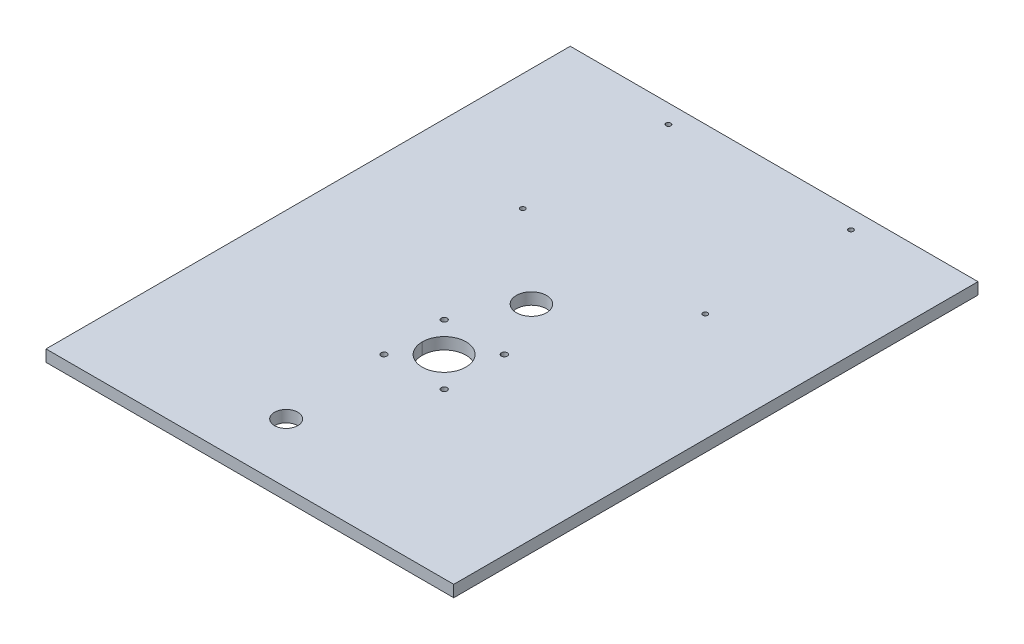
from build123d import *

# Parameters (mm, degrees)
SKETCH1_W           = 210
SKETCH1_H           = 270
SKETCH1_R           = 7.75
BOSS_EXTRUDE2_DEPTH = 6
CUT_EXTRUDE1_DEPTH  = 10
SKETCH4_R           = 1.25
CUT_EXTRUDE2_DEPTH  = 10
SKETCH5_R           = 6
CUT_EXTRUDE3_DEPTH  = 10


with BuildPart() as part:
    # Sketch1 → Boss-Extrude2 (new body)
    with BuildSketch(Plane(origin=(0, 0, 0), x_dir=(1, 0, 0), z_dir=(0, 1, 0))):
        with Locations((0, -10)):
            Rectangle(SKETCH1_W, SKETCH1_H)
        with Locations(Location((0, 0, 0), (0, 0, 270))):
            Circle(SKETCH1_R, mode=Mode.SUBTRACT)
    extrude(amount=BOSS_EXTRUDE2_DEPTH)

    # Sketch3 → Cut-Extrude1 (cut)
    with BuildSketch(Plane.XZ):
        with BuildLine():
            Line((17.000022153, 29.5), (17.000022153, 29.4))
            ThreePointArc((17.000022153, 29.4), (15.500022153, 27.9), (14.000022153, 29.4))
            Line((14.000022153, 29.4), (14.000022153, 29.5))
            ThreePointArc((14.000022153, 29.5), (15.500022153, 31), (17.000022153, 29.5))
        make_face()
        with BuildLine():
            Line((17.000022153, 60.5), (17.000022153, 60.4))
            ThreePointArc((17.000022153, 60.4), (15.500022153, 58.9), (14.000022153, 60.4))
            Line((14.000022153, 60.4), (14.000022153, 60.5))
            ThreePointArc((14.000022153, 60.5), (15.500022153, 62), (17.000022153, 60.5))
        make_face()
        with BuildLine():
            Line((-16.999993108, 29.500016738), (-16.999993206, 29.400016738))
            ThreePointArc((-16.999993206, 29.400016738), (-15.499994683, 27.900015261), (-13.999993206, 29.400013784))
            Line((-13.999993206, 29.400013784), (-13.999993108, 29.500013784))
            ThreePointArc((-13.999993108, 29.500013784), (-15.499991631, 31.000015261), (-16.999993108, 29.500016738))
        make_face()
        with BuildLine():
            Line((-16.999962586, 60.500016738), (-16.999962684, 60.400016738))
            ThreePointArc((-16.999962684, 60.400016738), (-15.499964161, 58.900015261), (-13.999962684, 60.400013784))
            Line((-13.999962684, 60.400013784), (-13.999962586, 60.500013784))
            ThreePointArc((-13.999962586, 60.500013784), (-15.499961109, 62.000015261), (-16.999962586, 60.500016738))
        make_face()
        with BuildLine():
            Line((11.250022153, 44.999994462), (11.250022104, 44.899994462))
            ThreePointArc((11.250022104, 44.899994462), (1.6566e-05, 33.65), (-11.249977896, 44.900005538))
            Line((-11.249977896, 44.900005538), (-11.249977847, 45.000005538))
            ThreePointArc((-11.249977847, 45.000005538), (2.7692e-05, 56.25), (11.250022153, 44.999994462))
        make_face()
    extrude(amount=-CUT_EXTRUDE1_DEPTH, mode=Mode.SUBTRACT)

    # Sketch4 → Cut-Extrude2 (cut)
    with BuildSketch(Plane.XZ):
        with Locations(Location((49.170333674, -115.382230576, 0), (0, 0, 270))):
            Circle(SKETCH4_R)
        with Locations(Location((-44.829666326, -115.382230576, 0), (0, 0, 270))):
            Circle(SKETCH4_R)
        with Locations(Location((49.170333674, -40.382230576, 0), (0, 0, 270))):
            Circle(SKETCH4_R)
        with Locations(Location((-44.829666326, -40.382230576, 0), (0, 0, 270))):
            Circle(SKETCH4_R)
    extrude(amount=-CUT_EXTRUDE2_DEPTH, mode=Mode.SUBTRACT)

    # Sketch5 → Cut-Extrude3 (cut)
    with BuildSketch(Plane(origin=(0, 6, 0), x_dir=(1, 0, 0), z_dir=(0, 1, 0))):
        with Locations(Location((-11.927460167, -114.387337557, 0), (0, 0, 270))):
            Circle(SKETCH5_R)
    extrude(amount=-CUT_EXTRUDE3_DEPTH, mode=Mode.SUBTRACT)


solid = part.part
